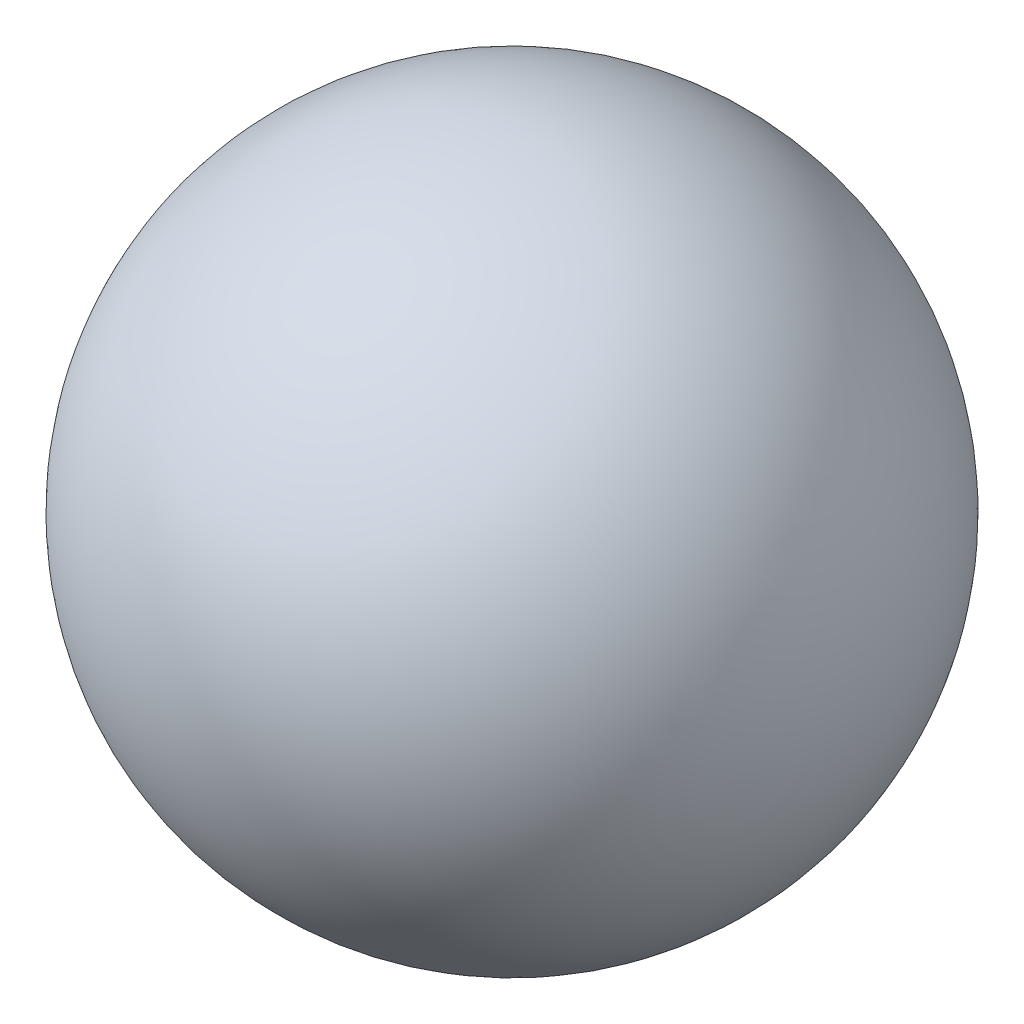
from build123d import *


with BuildPart() as part:
    # Sketch1 → Revolve3 (revolve)
    with BuildSketch(Plane(origin=(0, 0, 0), x_dir=(1, 0, 0), z_dir=(0, 1, 0))):
        with BuildLine():
            ThreePointArc((20.492549464, 15.267438817), (-9.507450536, 45.267438817), (-39.507450536, 15.267438817))
            Line((-39.507450536, 15.267438817), (20.492549464, 15.267438817))
        make_face()
    revolve(axis=Axis((-39.507450536, 0, -15.267438817), (1, 0, 0)))


solid = part.part
